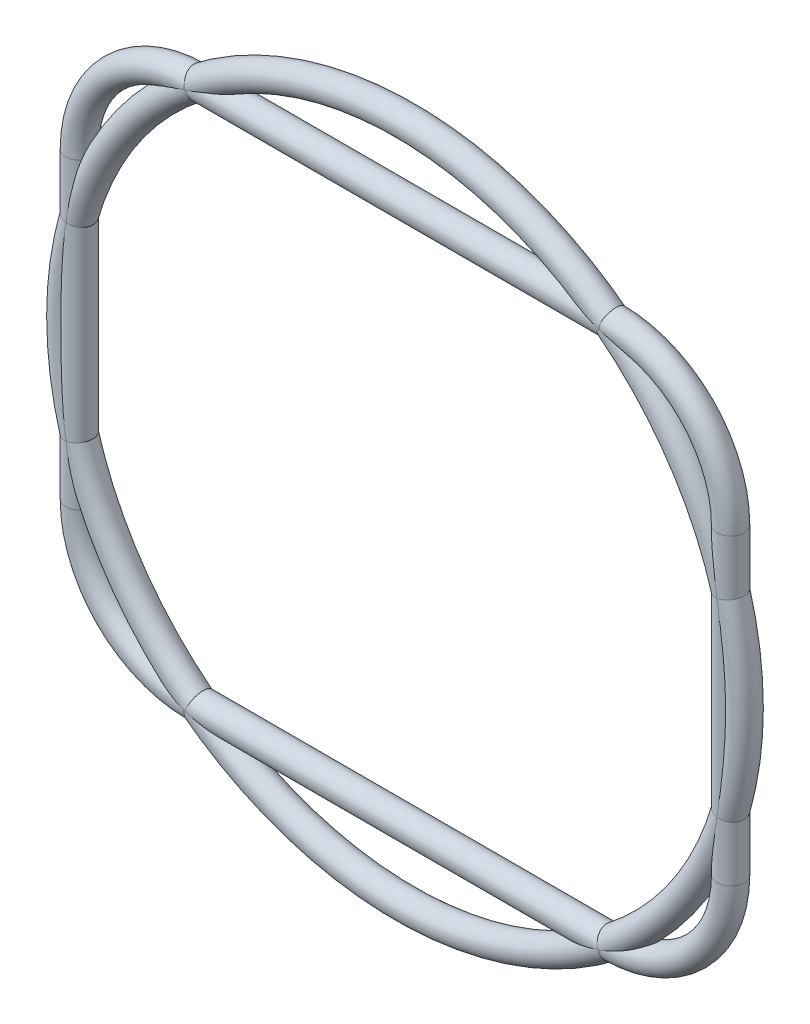
from build123d import *

# Parameters (mm, degrees)
SKETCH1_R = 1.5
SKETCH3_R = 1.5


with BuildPart() as part:
    # Sketch1 → Revolve1 (revolve)
    with BuildSketch(Plane(origin=(0, 0, 0), x_dir=(0, 0, -1), z_dir=(1, 0, 0)), mode=Mode.PRIVATE) as revolve1_sk:
        with Locations((0, 37.5)):
            Circle(SKETCH1_R)
    revolve(revolve1_sk.sketch.rotate(Axis((0, 0, 0), (0, 0, -1)), 90), axis=Axis((0, 0, 0), (0, 0, -1)))


with BuildPart() as body_2:
    # Sweep1: sweep along a path in Sketch2
    with BuildLine(Plane.XY) as sweep1_path:
        Line((-23, 29.75), (23, 29.75))
        ThreePointArc((23, 29.75), (32.192388155, 25.942388155), (36, 16.75))
        Line((36, 16.75), (36, -16.75))
        ThreePointArc((36, -16.75), (32.192388155, -25.942388155), (23, -29.75))
        Line((23, -29.75), (-23, -29.75))
        ThreePointArc((-23, -29.75), (-32.192388155, -25.942388155), (-36, -16.75))
        Line((-36, -16.75), (-36, 16.75))
        ThreePointArc((-36, 16.75), (-32.192388155, 25.942388155), (-23, 29.75))
    # Sketch3 → Sweep1 (sweep)
    with BuildSketch(Plane(origin=(0, 0, 0), x_dir=(0, 0, -1), z_dir=(1, 0, 0))):
        with Locations((0, 29.75)):
            Circle(SKETCH3_R)
    sweep(path=sweep1_path.line)


solid = Compound([part.part, body_2.part])
